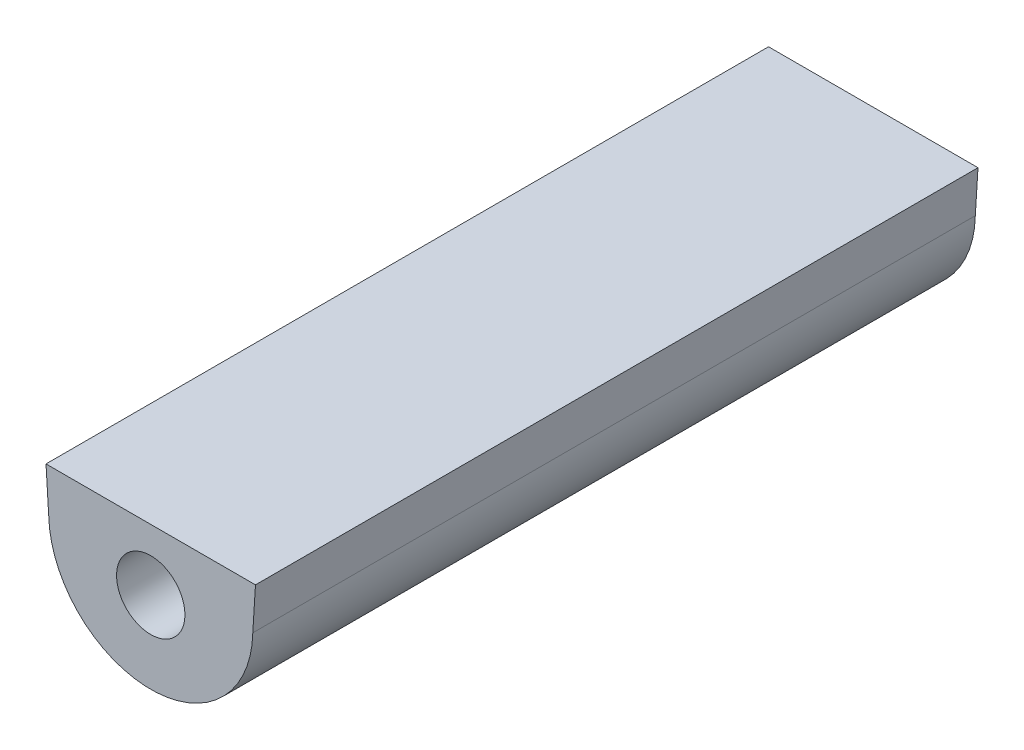
from build123d import *

# Parameters (mm, degrees)
SKETCH1_R           = 2.127
SKETCH1_R_2         = 2.032
BOSS_EXTRUDE1_DEPTH = 44.958
SKETCH2_W           = 61.162711876
SKETCH2_H           = 56.657422832
CUT_EXTRUDE1_DEPTH  = 57.200072865


with BuildPart() as part:
    # Sketch1 → Boss-Extrude1 (new body)
    with BuildSketch(Plane.XY):
        with BuildLine():
            Line((6.662551774, -21.675328207), (9.781210426, 28.223210221))
            ThreePointArc((9.781210426, 28.223210221), (8.75546188, 31.069569496), (5.978630102, 32.270871491))
            Line((5.978630102, 32.270871491), (-5.353526553, 32.270871491))
            ThreePointArc((-5.353526553, 32.270871491), (-8.130358331, 31.069569496), (-9.156106877, 28.223210221))
            Line((-9.156106877, 28.223210221), (-6.037448226, -21.675328207))
            ThreePointArc((-6.037448226, -21.675328207), (0.312551774, -27.895146648), (6.662551774, -21.675328207))
        make_face()
        with Locations((0.312551774, -22.815146648)):
            Circle(SKETCH1_R, mode=Mode.SUBTRACT)
        with Locations((0.312551774, 0.044853352)):
            Circle(SKETCH1_R, mode=Mode.SUBTRACT)
        with Locations((0.312551774, 22.110871491)):
            Circle(SKETCH1_R_2, mode=Mode.SUBTRACT)
    extrude(amount=BOSS_EXTRUDE1_DEPTH)

    # Sketch2 → Cut-Extrude1 (cut, through all)
    with BuildSketch(Plane.XY.offset(44.958)):
        with Locations((2.830749484, 9.323564768)):
            Rectangle(SKETCH2_W, SKETCH2_H)
    extrude(amount=-CUT_EXTRUDE1_DEPTH, mode=Mode.SUBTRACT)


solid = part.part
